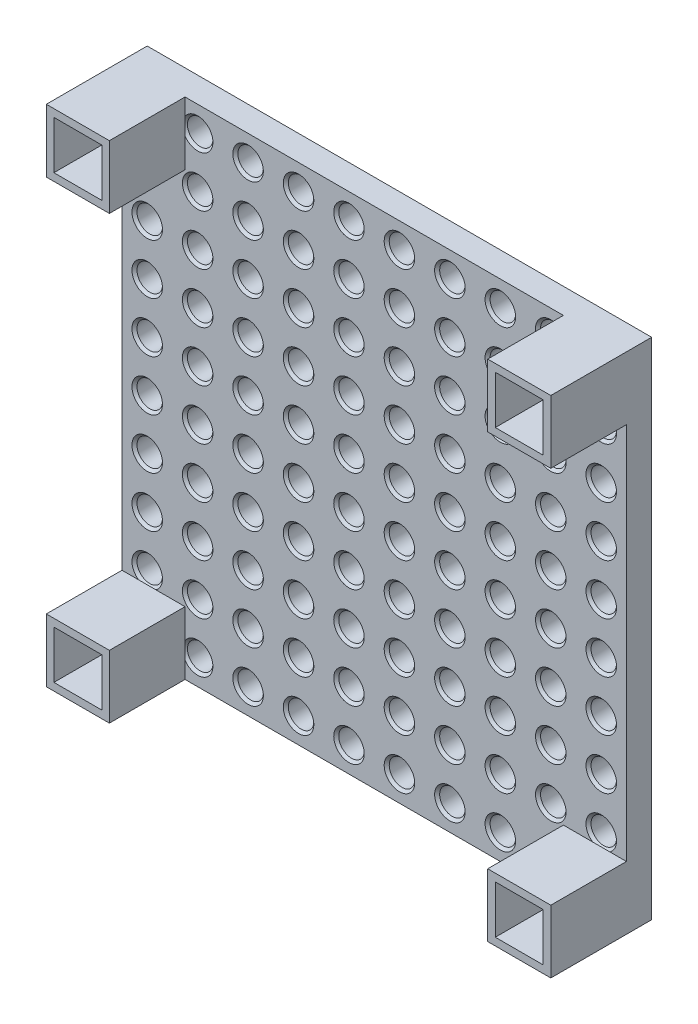
from build123d import *

# Parameters (mm, degrees)
SKETCH1_W                  = 200
SKETCH1_H                  = 200
BOSS_EXTRUDE1_DEPTH        = 10
SKETCH2_R                  = 5.05
CUT_EXTRUDE1_DEPTH         = 10
CHAMFER1_SIZE              = 1
LPATTERN2_COUNT            = 10
LPATTERN2_PITCH            = 20
LPATTERN2_COUNT_DIR2       = 10
LPATTERN2_PITCH_DIR2       = 20
CHAMFER1_OF_LPATTERN2_SIZE = 1
SKETCH3_W                  = 25
SKETCH3_H                  = 25
SKETCH3_W_2                = 19
SKETCH3_H_2                = 19
BOSS_EXTRUDE2_DEPTH        = 30
LPATTERN4_COUNT            = 2
LPATTERN4_PITCH            = 175
LPATTERN4_COUNT_DIR2       = 2
LPATTERN4_PITCH_DIR2       = 175


with BuildPart() as part:
    # Sketch1 → Boss-Extrude1 (new body)
    with BuildSketch(Plane.XY):
        Rectangle(SKETCH1_W, SKETCH1_H)
    extrude(amount=BOSS_EXTRUDE1_DEPTH)

    # Sketch2 → Cut-Extrude1 (cut)
    with BuildSketch(Plane.XY.offset(10)):
        with Locations((-90, 90)):
            Circle(SKETCH2_R)
    cut_extrude1 = extrude(amount=-CUT_EXTRUDE1_DEPTH, mode=Mode.SUBTRACT)

    # Chamfer1
    chamfer1_edges = [part.edges().sort_by_distance(p)[0] for p in [
        (-95.05, 90, 0),
        (-95.05, 90, 10),
    ]]
    chamfer(chamfer1_edges, length=CHAMFER1_SIZE)

    # LPattern2: Cut-Extrude1 10 × 10
    with Locations(*[(i * LPATTERN2_PITCH, -j * LPATTERN2_PITCH_DIR2, 0) for i in range(LPATTERN2_COUNT) for j in range(LPATTERN2_COUNT_DIR2) if (i, j) != (0, 0)]):
        add(cut_extrude1, mode=Mode.SUBTRACT)

    # Chamfer1 of LPattern2
    chamfer1_of_lpattern2_edges = [part.edges().sort_by_distance(p)[0] for p in [
        (-95.05, 70, 0),
        (-95.05, 70, 10),
        (-95.05, 50, 0),
        (-95.05, 50, 10),
        (-95.05, 30, 0),
        (-95.05, 30, 10),
        (-95.05, 10, 0),
        (-95.05, 10, 10),
        (-95.05, -10, 0),
        (-95.05, -10, 10),
        (-95.05, -30, 0),
        (-95.05, -30, 10),
        (-95.05, -50, 0),
        (-95.05, -50, 10),
        (-95.05, -70, 0),
        (-95.05, -70, 10),
        (-95.05, -90, 0),
        (-95.05, -90, 10),
        (-75.05, 90, 0),
        (-75.05, 90, 10),
        (-75.05, 70, 0),
        (-75.05, 70, 10),
        (-75.05, 50, 0),
        (-75.05, 50, 10),
        (-75.05, 30, 0),
        (-75.05, 30, 10),
        (-75.05, 10, 0),
        (-75.05, 10, 10),
        (-75.05, -10, 0),
        (-75.05, -10, 10),
        (-75.05, -30, 0),
        (-75.05, -30, 10),
        (-75.05, -50, 0),
        (-75.05, -50, 10),
        (-75.05, -70, 0),
        (-75.05, -70, 10),
        (-75.05, -90, 0),
        (-75.05, -90, 10),
        (-55.05, 90, 0),
        (-55.05, 90, 10),
        (-55.05, 70, 0),
        (-55.05, 70, 10),
        (-55.05, 50, 0),
        (-55.05, 50, 10),
        (-55.05, 30, 0),
        (-55.05, 30, 10),
        (-55.05, 10, 0),
        (-55.05, 10, 10),
        (-55.05, -10, 0),
        (-55.05, -10, 10),
        (-55.05, -30, 0),
        (-55.05, -30, 10),
        (-55.05, -50, 0),
        (-55.05, -50, 10),
        (-55.05, -70, 0),
        (-55.05, -70, 10),
        (-55.05, -90, 0),
        (-55.05, -90, 10),
        (-35.05, 90, 0),
        (-35.05, 90, 10),
        (-35.05, 70, 0),
        (-35.05, 70, 10),
        (-35.05, 50, 0),
        (-35.05, 50, 10),
        (-35.05, 30, 0),
        (-35.05, 30, 10),
        (-35.05, 10, 0),
        (-35.05, 10, 10),
        (-35.05, -10, 0),
        (-35.05, -10, 10),
        (-35.05, -30, 0),
        (-35.05, -30, 10),
        (-35.05, -50, 0),
        (-35.05, -50, 10),
        (-35.05, -70, 0),
        (-35.05, -70, 10),
        (-35.05, -90, 0),
        (-35.05, -90, 10),
        (-15.05, 90, 0),
        (-15.05, 90, 10),
        (-15.05, 70, 0),
        (-15.05, 70, 10),
        (-15.05, 50, 0),
        (-15.05, 50, 10),
        (-15.05, 30, 0),
        (-15.05, 30, 10),
        (-15.05, 10, 0),
        (-15.05, 10, 10),
        (-15.05, -10, 0),
        (-15.05, -10, 10),
        (-15.05, -30, 0),
        (-15.05, -30, 10),
        (-15.05, -50, 0),
        (-15.05, -50, 10),
        (-15.05, -70, 0),
        (-15.05, -70, 10),
        (-15.05, -90, 0),
        (-15.05, -90, 10),
        (4.95, 90, 0),
        (4.95, 90, 10),
        (4.95, 70, 0),
        (4.95, 70, 10),
        (4.95, 50, 0),
        (4.95, 50, 10),
        (4.95, 30, 0),
        (4.95, 30, 10),
        (4.95, 10, 0),
        (4.95, 10, 10),
        (4.95, -10, 0),
        (4.95, -10, 10),
        (4.95, -30, 0),
        (4.95, -30, 10),
        (4.95, -50, 0),
        (4.95, -50, 10),
        (4.95, -70, 0),
        (4.95, -70, 10),
        (4.95, -90, 0),
        (4.95, -90, 10),
        (24.95, 90, 0),
        (24.95, 90, 10),
        (24.95, 70, 0),
        (24.95, 70, 10),
        (24.95, 50, 0),
        (24.95, 50, 10),
        (24.95, 30, 0),
        (24.95, 30, 10),
        (24.95, 10, 0),
        (24.95, 10, 10),
        (24.95, -10, 0),
        (24.95, -10, 10),
        (24.95, -30, 0),
        (24.95, -30, 10),
        (24.95, -50, 0),
        (24.95, -50, 10),
        (24.95, -70, 0),
        (24.95, -70, 10),
        (24.95, -90, 0),
        (24.95, -90, 10),
        (44.95, 90, 0),
        (44.95, 90, 10),
        (44.95, 70, 0),
        (44.95, 70, 10),
        (44.95, 50, 0),
        (44.95, 50, 10),
        (44.95, 30, 0),
        (44.95, 30, 10),
        (44.95, 10, 0),
        (44.95, 10, 10),
        (44.95, -10, 0),
        (44.95, -10, 10),
        (44.95, -30, 0),
        (44.95, -30, 10),
        (44.95, -50, 0),
        (44.95, -50, 10),
        (44.95, -70, 0),
        (44.95, -70, 10),
        (44.95, -90, 0),
        (44.95, -90, 10),
        (64.95, 90, 0),
        (64.95, 90, 10),
        (64.95, 70, 0),
        (64.95, 70, 10),
        (64.95, 50, 0),
        (64.95, 50, 10),
        (64.95, 30, 0),
        (64.95, 30, 10),
        (64.95, 10, 0),
        (64.95, 10, 10),
        (64.95, -10, 0),
        (64.95, -10, 10),
        (64.95, -30, 0),
        (64.95, -30, 10),
        (64.95, -50, 0),
        (64.95, -50, 10),
        (64.95, -70, 0),
        (64.95, -70, 10),
        (64.95, -90, 0),
        (64.95, -90, 10),
        (84.95, 90, 0),
        (84.95, 90, 10),
        (84.95, 70, 0),
        (84.95, 70, 10),
        (84.95, 50, 0),
        (84.95, 50, 10),
        (84.95, 30, 0),
        (84.95, 30, 10),
        (84.95, 10, 0),
        (84.95, 10, 10),
        (84.95, -10, 0),
        (84.95, -10, 10),
        (84.95, -30, 0),
        (84.95, -30, 10),
        (84.95, -50, 0),
        (84.95, -50, 10),
        (84.95, -70, 0),
        (84.95, -70, 10),
        (84.95, -90, 0),
        (84.95, -90, 10),
    ]]
    chamfer(chamfer1_of_lpattern2_edges, length=CHAMFER1_OF_LPATTERN2_SIZE)

    # Sketch3 → Boss-Extrude2 (add)
    with BuildSketch(Plane.XY.offset(10)):
        with Locations((-87.5, 87.5)):
            Rectangle(SKETCH3_W, SKETCH3_H)
        with Locations((-87.5, 87.5)):
            Rectangle(SKETCH3_W_2, SKETCH3_H_2, mode=Mode.SUBTRACT)
    boss_extrude2 = extrude(amount=BOSS_EXTRUDE2_DEPTH)

    # LPattern4: Boss-Extrude2 2 × 2
    with Locations(*[(i * LPATTERN4_PITCH, -j * LPATTERN4_PITCH_DIR2, 0) for i in range(LPATTERN4_COUNT) for j in range(LPATTERN4_COUNT_DIR2) if (i, j) != (0, 0)]):
        add(boss_extrude2)


solid = part.part
